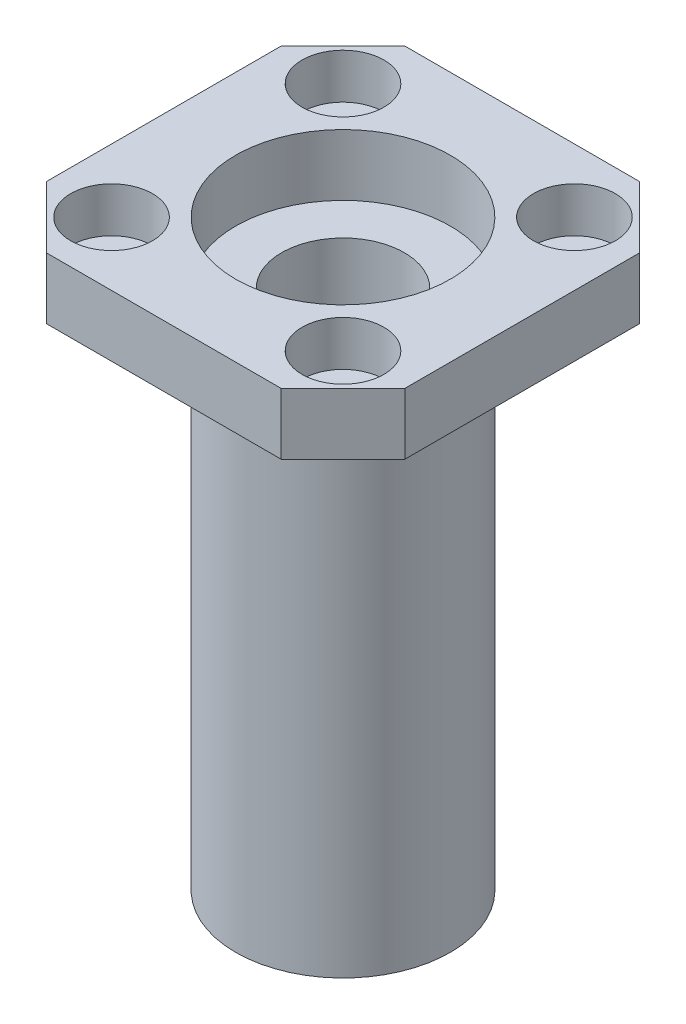
from build123d import *

# Parameters (mm, degrees)
SKETCH1_R           = 10.5
SKETCH1_R_2         = 6
BOSS_EXTRUDE1_DEPTH = 51
SKETCH2_R           = 2.25
SKETCH2_R_2         = 10.5
BOSS_EXTRUDE2_DEPTH = 6
SKETCH3_R           = 4
CUT_EXTRUDE1_DEPTH  = 4.4


with BuildPart() as part:
    # Sketch1 → Boss-Extrude1 (new body)
    with BuildSketch(Plane(origin=(0, 0, 0), x_dir=(1, 0, 0), z_dir=(0, 1, 0))):
        with Locations(Location((0, 0, 0), (0, 0, 270))):
            Circle(SKETCH1_R)
        with Locations(Location((0, 0, 0), (0, 0, 270))):
            Circle(SKETCH1_R_2, mode=Mode.SUBTRACT)
    extrude(amount=BOSS_EXTRUDE1_DEPTH)


with BuildPart() as body_2:
    # Sketch2 → Boss-Extrude2 (new body)
    with BuildSketch(Plane(origin=(0, 51, 0), x_dir=(1, 0, 0), z_dir=(0, 1, 0))):
        Polygon((-17.516545186, 11.474832843), (-17.516545186, -11.474832843), (-11.474832843, -17.516545186), (11.474832843, -17.516545186), (17.516545186, -11.474832843), (17.516545186, 11.474832843), (11.474832843, 17.516545186), (-11.474832843, 17.516545186), align=None)
        with Locations(Location((11.313708499, 11.313708499, 0), (0, 0, 270))):
            Circle(SKETCH2_R, mode=Mode.SUBTRACT)
        with Locations(Location((-11.313708499, 11.313708499, 0), (0, 0, 270))):
            Circle(SKETCH2_R, mode=Mode.SUBTRACT)
        with Locations(Location((-11.313708499, -11.313708499, 0), (0, 0, 270))):
            Circle(SKETCH2_R, mode=Mode.SUBTRACT)
        with Locations(Location((11.313708499, -11.313708499, 0), (0, 0, 270))):
            Circle(SKETCH2_R, mode=Mode.SUBTRACT)
        with Locations(Location((0, 0, 0), (0, 0, 270))):
            Circle(SKETCH2_R_2, mode=Mode.SUBTRACT)
    extrude(amount=BOSS_EXTRUDE2_DEPTH)

    # Sketch3 → Cut-Extrude1 (cut)
    with BuildSketch(Plane(origin=(0, 57, 0), x_dir=(1, 0, 0), z_dir=(0, 1, 0))):
        with Locations(Location((-11.313708499, 11.313708499, 0), (0, 0, 270))):
            Circle(SKETCH3_R)
        with Locations(Location((-11.313708499, -11.313708499, 0), (0, 0, 270))):
            Circle(SKETCH3_R)
        with Locations(Location((11.313708499, -11.313708499, 0), (0, 0, 270))):
            Circle(SKETCH3_R)
        with Locations(Location((11.313708499, 11.313708499, 0), (0, 0, 270))):
            Circle(SKETCH3_R)
    extrude(amount=-CUT_EXTRUDE1_DEPTH, mode=Mode.SUBTRACT)


solid = Compound([part.part, body_2.part])
